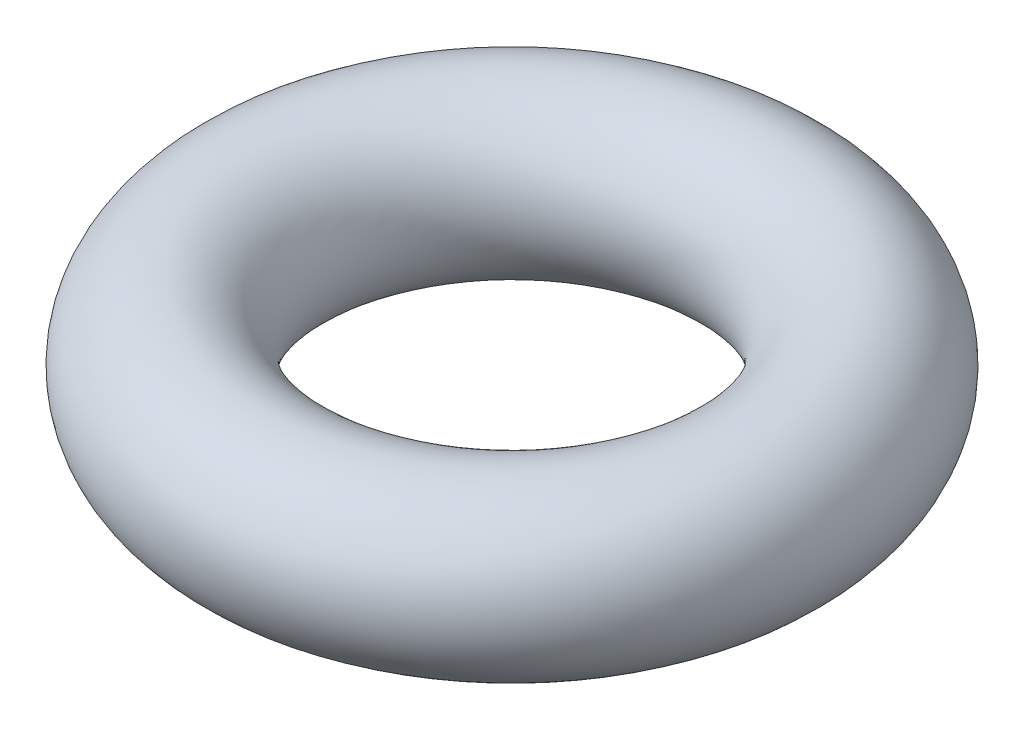
from build123d import *

# Parameters (mm, degrees)
SKETCH1_R = 1


with BuildPart() as part:
    # Sketch1 → Revolve1 (revolve)
    with BuildSketch(Plane.XY, mode=Mode.PRIVATE) as revolve1_sk:
        with Locations((3, 0)):
            Circle(SKETCH1_R)
    revolve(revolve1_sk.sketch.rotate(Axis((0, 2.317757009, 0), (0, -1, 0)), 180), axis=Axis((0, 2.317757009, 0), (0, -1, 0)))


solid = part.part
